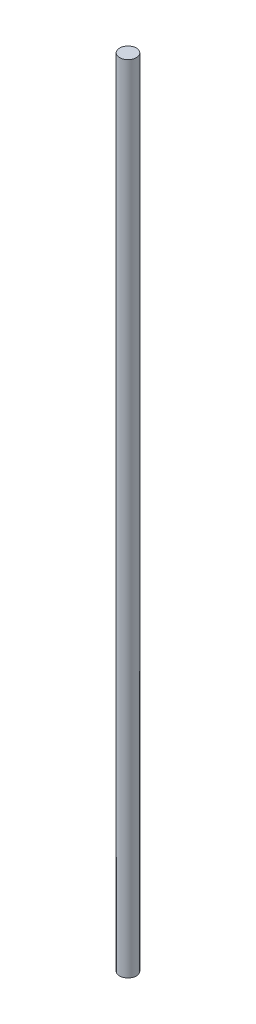
from build123d import *

# Parameters (mm, degrees)
SKETCH_1_R      = 1.05
EXTRUDE_1_DEPTH = 100


with BuildPart() as part:
    # 草图1 → 凸台-拉伸1 (new body)
    with BuildSketch(Plane(origin=(0, 0, 0), x_dir=(1, 0, 0), z_dir=(0, 1, 0))):
        with Locations(Location((0, 0, 0), (0, 0, 270))):
            Circle(SKETCH_1_R)
    extrude(amount=EXTRUDE_1_DEPTH)


solid = part.part
